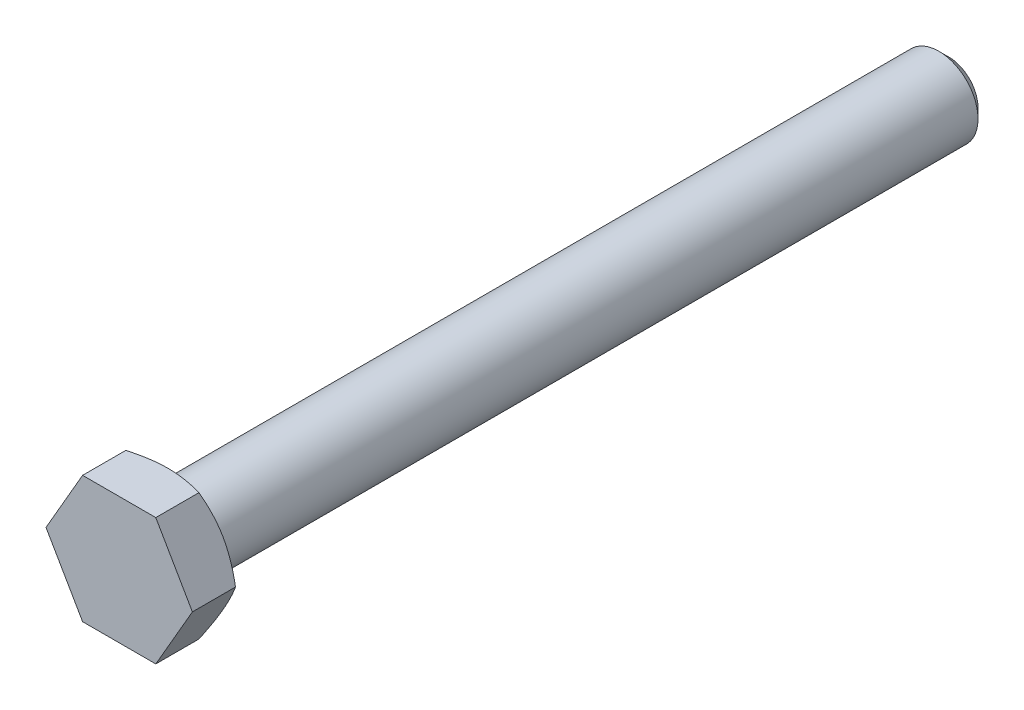
from build123d import *

# Parameters (mm, degrees)
DODANIE_WYCI_GNI_CIE2_DEPTH = 5
SZKIC3_OUTSIDE_W            = 55.734
SZKIC3_OUTSIDE_H            = 53.724
SZKIC3_OUTSIDE_R            = 6.495190528
WYTNIJ_WYCI_GNI_CIE2_DEPTH  = 10
WYTNIJ_WYCI_GNI_CIE2_DRAFT  = 60
SZKIC4_R                    = 4
DODANIE_WYCI_GNI_CIE3_DEPTH = 80
ZAOKR_GLENIE1_R             = 1
SFAZOWANIE1_SIZE            = 1


with BuildPart() as part:
    # Szkic1 → Dodanie-wyciągnięcie2 (new body)
    with BuildSketch(Plane.XY):
        Polygon((3.75, 6.495190528), (-3.75, 6.495190528), (-7.5, 0), (-3.75, -6.495190528), (3.75, -6.495190528), (7.5, 0), align=None)
    extrude(amount=DODANIE_WYCI_GNI_CIE2_DEPTH)


with BuildPart() as wytnij_wyci_gni_cie2_tool:
    # Szkic3 outside → Wytnij-wyciągnięcie2 (with draft: the straight prism first)
    with BuildSketch(Plane.XY):
        Rectangle(SZKIC3_OUTSIDE_W, SZKIC3_OUTSIDE_H)
        Circle(SZKIC3_OUTSIDE_R, mode=Mode.SUBTRACT)
    extrude(amount=WYTNIJ_WYCI_GNI_CIE2_DEPTH)
    # Wytnij-wyciągnięcie2: the draft: its side faces are tilted about the plane it starts from
    wytnij_wyci_gni_cie2_sides = [wytnij_wyci_gni_cie2_tool.faces().sort_by_distance(p)[0] for p in [
        (0, -26.862, 5),
        (27.867, 0, 5),
        (0, 26.862, 5),
        (-27.867, 0, 5),
        (-6.495190528, 0, 5),
    ]]
    draft(wytnij_wyci_gni_cie2_sides, Plane.XY, WYTNIJ_WYCI_GNI_CIE2_DRAFT)


with BuildPart() as part_1:
    add(part.part)

    # Wytnij-wyciągnięcie2: cut by wytnij_wyci_gni_cie2_tool
    add(wytnij_wyci_gni_cie2_tool.part, mode=Mode.SUBTRACT)

    # Szkic4 → Dodanie-wyciągnięcie3 (add)
    with BuildSketch(Plane.XY):
        Circle(SZKIC4_R)
    extrude(amount=-DODANIE_WYCI_GNI_CIE3_DEPTH)

    # Zaokrąglenie1
    zaokr_glenie1_edges = [part_1.edges().sort_by_distance(p)[0] for p in [
        (-4, 0, 0),
    ]]
    fillet(zaokr_glenie1_edges, radius=ZAOKR_GLENIE1_R)

    # Sfazowanie1
    sfazowanie1_edges = [part_1.edges().sort_by_distance(p)[0] for p in [
        (-4, 0, -80),
    ]]
    chamfer(sfazowanie1_edges, length=SFAZOWANIE1_SIZE)


solid = part_1.part
